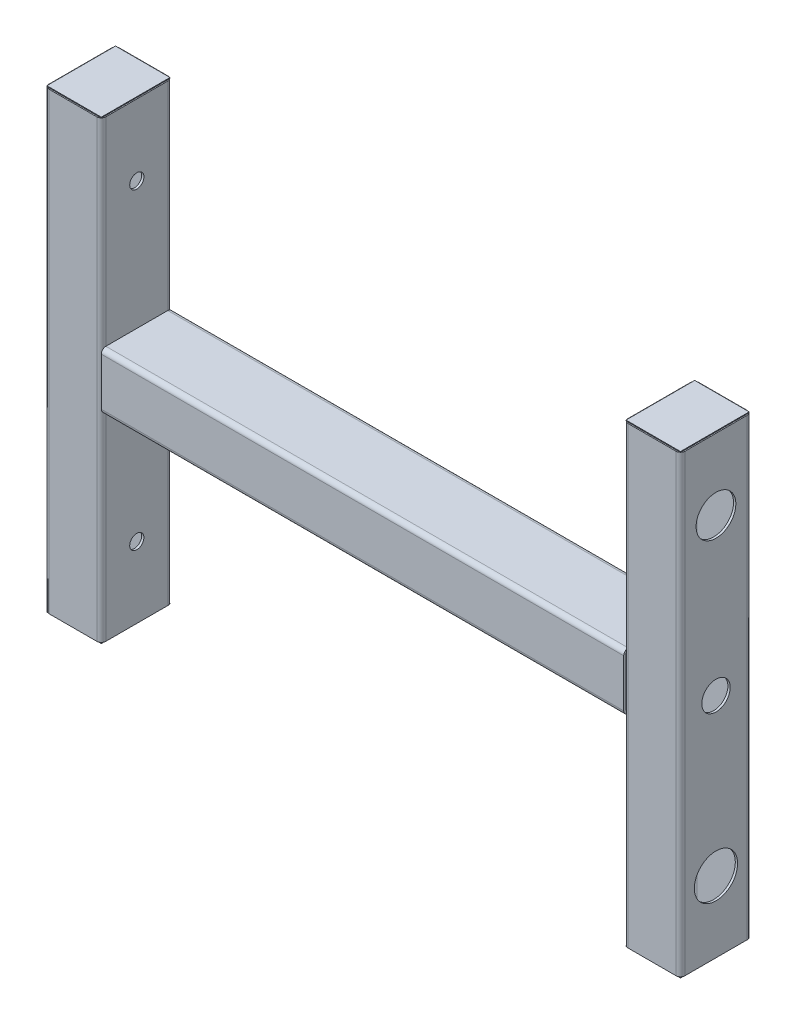
from build123d import *

# Parameters (mm, degrees)
MEMBER_1_DEPTH         = 1600
MEMBER_1_2_DEPTH       = 1600
MEMBER_2_DEPTH         = 2040
CUT_EXTRUDE_1_REACH    = 2383.853
SKETCH_2_R             = 70
SKETCH_2_R_2           = 76.128040806
SKETCH_3_R             = 50
CUT_EXTRUDE_2_DEPTH    = 2382.85327004
END_CAP_1_WIDTH        = 242
END_CAP_1_HEIGHT       = 192
END_CAP_1_THICKNESS    = 3
END_CAP_1_4_WIDTH      = 242
END_CAP_1_4_HEIGHT     = 192
END_CAP_1_4_THICKNESS  = 3
END_CAP_1_7_WIDTH      = 242
END_CAP_1_7_HEIGHT     = 192
END_CAP_1_7_THICKNESS  = 3
END_CAP_1_10_WIDTH     = 242
END_CAP_1_10_HEIGHT    = 192
END_CAP_1_10_THICKNESS = 3
CUT_EXTRUDE_3_REACH    = 2384.863
SKETCH_5_R             = 25


with BuildPart() as part:
    # Sketch1 → Member 1 (new body)
    with BuildSketch(Plane(origin=(-1020, 800, 0), x_dir=(1, 0, 0), z_dir=(0, -1, 0))):
        with BuildLine():
            Line((-84, -125), (84, -125))
            ThreePointArc((84, -125), (95.313708499, -120.313708499), (100, -109))
            Line((100, -109), (100, 109))
            ThreePointArc((100, 109), (95.313708499, 120.313708499), (84, 125))
            Line((84, 125), (-84, 125))
            ThreePointArc((-84, 125), (-95.313708499, 120.313708499), (-100, 109))
            Line((-100, 109), (-100, -109))
            ThreePointArc((-100, -109), (-95.313708499, -120.313708499), (-84, -125))
        make_face()
        with BuildLine():
            Line((-84, -117), (84, -117))
            ThreePointArc((84, -117), (89.656854249, -114.656854249), (92, -109))
            Line((92, -109), (92, 109))
            ThreePointArc((92, 109), (89.656854249, 114.656854249), (84, 117))
            Line((84, 117), (-84, 117))
            ThreePointArc((-84, 117), (-89.656854249, 114.656854249), (-92, 109))
            Line((-92, 109), (-92, -109))
            ThreePointArc((-92, -109), (-89.656854249, -114.656854249), (-84, -117))
        make_face(mode=Mode.SUBTRACT)
    extrude(amount=MEMBER_1_DEPTH)


with BuildPart() as body_2:
    # Sketch1 on segment 2 (carried to segment 2) → Member 1 2 (new body)
    with BuildSketch(Plane(origin=(1020, 800, 0), x_dir=(1, 0, 0), z_dir=(0, -1, 0))):
        with BuildLine():
            Line((-84, -125), (84, -125))
            ThreePointArc((84, -125), (95.313708499, -120.313708499), (100, -109))
            Line((100, -109), (100, 109))
            ThreePointArc((100, 109), (95.313708499, 120.313708499), (84, 125))
            Line((84, 125), (-84, 125))
            ThreePointArc((-84, 125), (-95.313708499, 120.313708499), (-100, 109))
            Line((-100, 109), (-100, -109))
            ThreePointArc((-100, -109), (-95.313708499, -120.313708499), (-84, -125))
        make_face()
        with BuildLine():
            Line((-84, -117), (84, -117))
            ThreePointArc((84, -117), (89.656854249, -114.656854249), (92, -109))
            Line((92, -109), (92, 109))
            ThreePointArc((92, 109), (89.656854249, 114.656854249), (84, 117))
            Line((84, 117), (-84, 117))
            ThreePointArc((-84, 117), (-89.656854249, 114.656854249), (-92, 109))
            Line((-92, 109), (-92, -109))
            ThreePointArc((-92, -109), (-89.656854249, -114.656854249), (-84, -117))
        make_face(mode=Mode.SUBTRACT)
    extrude(amount=MEMBER_1_2_DEPTH)

    # 切除-拉伸1: up to this face of the body (flat: up to its plane)
    cut_extrude_1_end = Plane(body_2.part.faces().sort_by_distance((920, 0, 0))[0])
    # 草图2 → 切除-拉伸1 (cut, up to the picked face)
    with BuildSketch(Plane(origin=(1120, 0, 0), x_dir=(0, 0, -1), z_dir=(1, 0, 0)), mode=Mode.PRIVATE) as cut_extrude_1_sk1:
        with Locations((0, 550)):
            Circle(SKETCH_2_R)
    cut_extrude_1_tool1 = split(extrude(cut_extrude_1_sk1.sketch, amount=-CUT_EXTRUDE_1_REACH, mode=Mode.PRIVATE), bisect_by=cut_extrude_1_end, keep=Keep.BOTH, mode=Mode.PRIVATE)
    # 草图2 → 切除-拉伸1 (cut, up to the picked face)
    with BuildSketch(Plane(origin=(1120, 0, 0), x_dir=(0, 0, -1), z_dir=(1, 0, 0)), mode=Mode.PRIVATE) as cut_extrude_1_sk2:
        with Locations((0, -550)):
            Circle(SKETCH_2_R_2)
    cut_extrude_1_tool2 = split(extrude(cut_extrude_1_sk2.sketch, amount=-CUT_EXTRUDE_1_REACH, mode=Mode.PRIVATE), bisect_by=cut_extrude_1_end, keep=Keep.BOTH, mode=Mode.PRIVATE)
    add(cut_extrude_1_tool1.solids().sort_by(Axis((1120, 550, 0), (-1, 0, 0)))[0], mode=Mode.SUBTRACT)
    add(cut_extrude_1_tool2.solids().sort_by(Axis((1120, -550, 0), (-1, 0, 0)))[0], mode=Mode.SUBTRACT)


with BuildPart() as body_3:
    # Sketch11 → Member 2 (new body)
    with BuildSketch(Plane.YZ.offset(-1020)):
        with BuildLine():
            Line((-84, -125), (84, -125))
            ThreePointArc((84, -125), (95.313708499, -120.313708499), (100, -109))
            Line((100, -109), (100, 109))
            ThreePointArc((100, 109), (95.313708499, 120.313708499), (84, 125))
            Line((84, 125), (-84, 125))
            ThreePointArc((-84, 125), (-95.313708499, 120.313708499), (-100, 109))
            Line((-100, 109), (-100, -109))
            ThreePointArc((-100, -109), (-95.313708499, -120.313708499), (-84, -125))
        make_face()
        with BuildLine():
            Line((-84, -117), (84, -117))
            ThreePointArc((84, -117), (89.656854249, -114.656854249), (92, -109))
            Line((92, -109), (92, 109))
            ThreePointArc((92, 109), (89.656854249, 114.656854249), (84, 117))
            Line((84, 117), (-84, 117))
            ThreePointArc((-84, 117), (-89.656854249, 114.656854249), (-92, 109))
            Line((-92, 109), (-92, -109))
            ThreePointArc((-92, -109), (-89.656854249, -114.656854249), (-84, -117))
        make_face(mode=Mode.SUBTRACT)
    extrude(amount=MEMBER_2_DEPTH)

    # Weld Trim 1 41
    split(bisect_by=Plane.YZ.offset(-920), keep=Keep.TOP)

    # Weld Trim 1 48
    split(bisect_by=Plane(origin=(920, 0, 0), x_dir=(0, -1, 0), z_dir=(-1, 0, 0)), keep=Keep.TOP)


with BuildPart() as cut_extrude_2_tool:
    # 草图3 → 切除-拉伸2 (new, through all)
    with BuildSketch(Plane(origin=(1120, 0, 0), x_dir=(0, 0, -1), z_dir=(1, 0, 0))):
        Circle(SKETCH_3_R)
    extrude(amount=-CUT_EXTRUDE_2_DEPTH)


with BuildPart() as part_1:
    add(part.part)

    # 切除-拉伸2: cut by cut_extrude_2_tool
    add(cut_extrude_2_tool.part, mode=Mode.SUBTRACT)

    # 切除-拉伸3: up to this face of the body (flat: up to its plane)
    cut_extrude_3_end = Plane(part_1.part.faces().sort_by_distance((-920, 0, -92.852170424))[0])
    # 草图5 → 切除-拉伸3 (cut, up to the picked face)
    with BuildSketch(Plane.ZY.offset(1120), mode=Mode.PRIVATE) as cut_extrude_3_sk1:
        with Locations((0, 550)):
            Circle(SKETCH_5_R)
    cut_extrude_3_tool1 = split(extrude(cut_extrude_3_sk1.sketch, amount=-CUT_EXTRUDE_3_REACH, mode=Mode.PRIVATE), bisect_by=cut_extrude_3_end, keep=Keep.BOTH, mode=Mode.PRIVATE)
    # 草图5 → 切除-拉伸3 (cut, up to the picked face)
    with BuildSketch(Plane.ZY.offset(1120), mode=Mode.PRIVATE) as cut_extrude_3_sk2:
        with Locations((0, -550)):
            Circle(SKETCH_5_R)
    cut_extrude_3_tool2 = split(extrude(cut_extrude_3_sk2.sketch, amount=-CUT_EXTRUDE_3_REACH, mode=Mode.PRIVATE), bisect_by=cut_extrude_3_end, keep=Keep.BOTH, mode=Mode.PRIVATE)
    add(cut_extrude_3_tool1.solids().sort_by(Axis((-1120, 550, 0), (1, 0, 0)))[0], mode=Mode.SUBTRACT)
    add(cut_extrude_3_tool2.solids().sort_by(Axis((-1120, -550, 0), (1, 0, 0)))[0], mode=Mode.SUBTRACT)


with BuildPart() as body_2_1:
    add(body_2.part)

    # 切除-拉伸2: cut by cut_extrude_2_tool
    add(cut_extrude_2_tool.part, mode=Mode.SUBTRACT)


with BuildPart() as body_4:
    # End Cap 1: an end cap: a rectangular plate 3.0 thick over the member's open end
    with BuildSketch(Plane(origin=(1020, 800, 0), x_dir=(0, 0, 1), z_dir=(0, 1, 0))):
        Rectangle(END_CAP_1_WIDTH, END_CAP_1_HEIGHT)
    extrude(amount=END_CAP_1_THICKNESS)


with BuildPart() as body_5:
    # End Cap 1 4: an end cap: a rectangular plate 3.0 thick over the member's open end
    with BuildSketch(Plane(origin=(-1020, 800, 0), x_dir=(0, 0, 1), z_dir=(0, 1, 0))):
        Rectangle(END_CAP_1_4_WIDTH, END_CAP_1_4_HEIGHT)
    extrude(amount=END_CAP_1_4_THICKNESS)


with BuildPart() as body_6:
    # End Cap 1 7: an end cap: a rectangular plate 3.0 thick over the member's open end
    with BuildSketch(Plane(origin=(1020, -800, 0), x_dir=(0, 0, 1), z_dir=(0, -1, 0))):
        Rectangle(END_CAP_1_7_WIDTH, END_CAP_1_7_HEIGHT)
    extrude(amount=END_CAP_1_7_THICKNESS)


with BuildPart() as body_7:
    # End Cap 1 10: an end cap: a rectangular plate 3.0 thick over the member's open end
    with BuildSketch(Plane(origin=(-1020, -800, 0), x_dir=(0, 0, 1), z_dir=(0, -1, 0))):
        Rectangle(END_CAP_1_10_WIDTH, END_CAP_1_10_HEIGHT)
    extrude(amount=END_CAP_1_10_THICKNESS)


solid = Compound([body_3.part, part_1.part, body_2_1.part, body_4.part, body_5.part, body_6.part, body_7.part])
